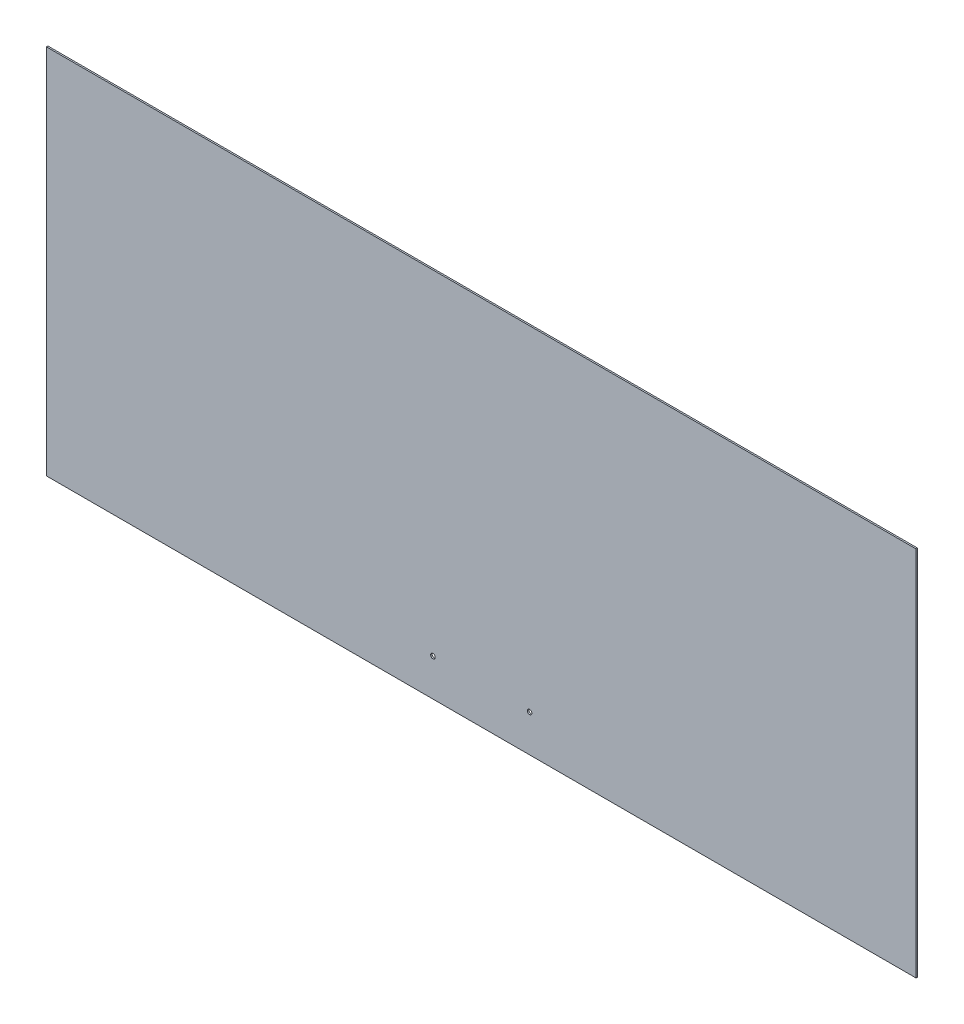
from build123d import *

# Parameters (mm, degrees)
SKETCH1_W           = 1170
SKETCH1_H           = 500
BOSS_EXTRUDE1_DEPTH = 2
SKETCH2_R           = 3.1
CUT_EXTRUDE1_DEPTH  = 1273.361583827


with BuildPart() as part:
    # Sketch1 → Boss-Extrude1 (new body)
    with BuildSketch(Plane.XY):
        with Locations((585, -250)):
            Rectangle(SKETCH1_W, SKETCH1_H)
    extrude(amount=BOSS_EXTRUDE1_DEPTH)

    # Sketch2 → Cut-Extrude1 (cut, through all)
    with BuildSketch(Plane.XY.offset(2)):
        with Locations((520, -450)):
            Circle(SKETCH2_R)
        with Locations((650, -450)):
            Circle(SKETCH2_R)
    extrude(amount=-CUT_EXTRUDE1_DEPTH, mode=Mode.SUBTRACT)


solid = part.part
